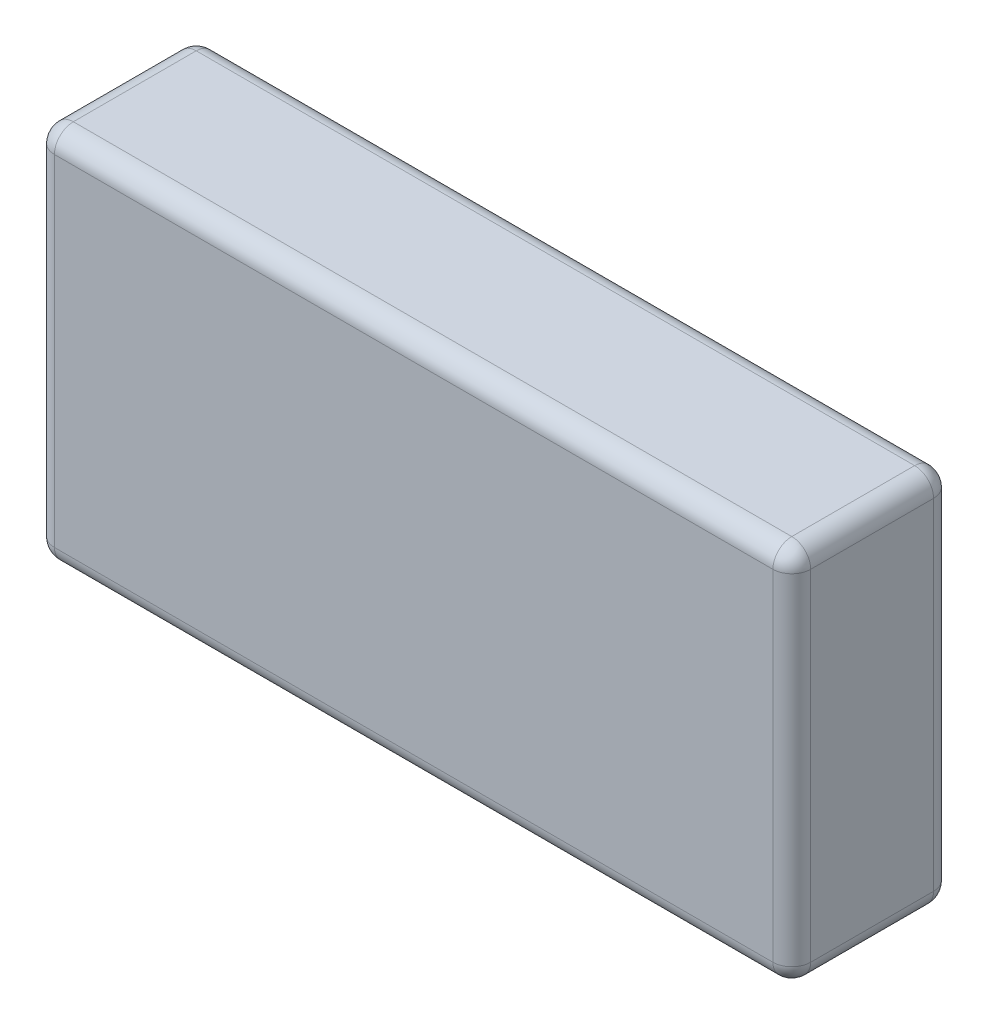
from build123d import *

# Parameters (mm, degrees)
SKETCH_1_W      = 80
SKETCH_1_H      = 40
EXTRUDE_1_DEPTH = 17
FILLET_1_R      = 2
FILLET_2_R      = 2


with BuildPart() as part:
    # 草图1 → 凸台-拉伸1 (new body)
    with BuildSketch(Plane.XY):
        with Locations((40, 20)):
            Rectangle(SKETCH_1_W, SKETCH_1_H)
    extrude(amount=EXTRUDE_1_DEPTH)

    # 圆角1
    fillet_1_edges = [part.edges().sort_by_distance(p)[0] for p in [
        (0, 40, 8.5),
        (80, 40, 8.5),
        (80, 0, 8.5),
        (0, 0, 8.5),
    ]]
    fillet(fillet_1_edges, radius=FILLET_1_R)

    # 圆角2
    fillet_2_edges = [part.edges().sort_by_distance(p)[0] for p in [
        (40, 0, 0),
        (40, 0, 17),
        (0, 20, 0),
        (40, 40, 0),
        (80, 20, 0),
        (0.585786438, 39.414213562, 0),
        (79.414213562, 39.414213562, 0),
        (79.414213562, 0.585786438, 0),
        (0.585786438, 0.585786438, 0),
        (0, 20, 17),
        (80, 20, 17),
        (40, 40, 17),
        (0.585786438, 39.414213562, 17),
        (79.414213562, 39.414213562, 17),
        (79.414213562, 0.585786438, 17),
        (0.585786438, 0.585786438, 17),
    ]]
    fillet(fillet_2_edges, radius=FILLET_2_R)


solid = part.part
